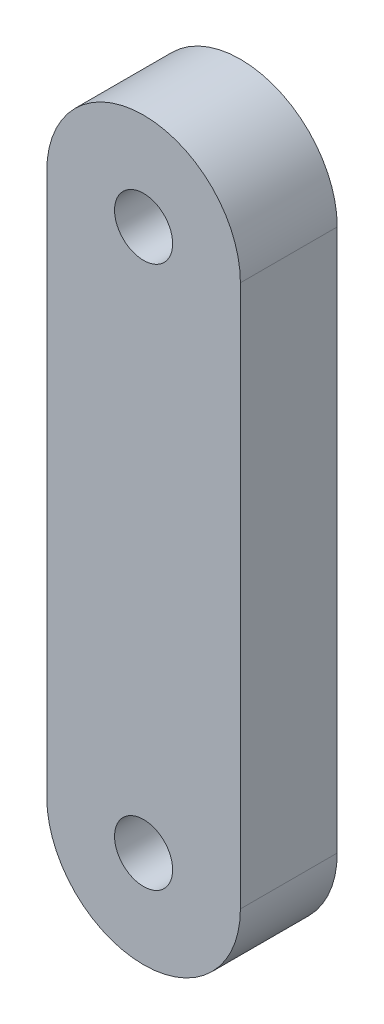
from build123d import *

# Parameters (mm, degrees)
SKETCH1_R           = 1.5
BOSS_EXTRUDE1_DEPTH = 5


with BuildPart() as part:
    # Sketch1 → Boss-Extrude1 (new body)
    with BuildSketch(Plane.XY):
        with BuildLine():
            Line((-5, 0), (-5, 28))
            ThreePointArc((-5, 28), (0, 33), (5, 28))
            Line((5, 28), (5, 0))
            ThreePointArc((5, 0), (0, -5), (-5, 0))
        make_face()
        Circle(SKETCH1_R, mode=Mode.SUBTRACT)
        with Locations((0, 28)):
            Circle(SKETCH1_R, mode=Mode.SUBTRACT)
    extrude(amount=BOSS_EXTRUDE1_DEPTH)


solid = part.part
